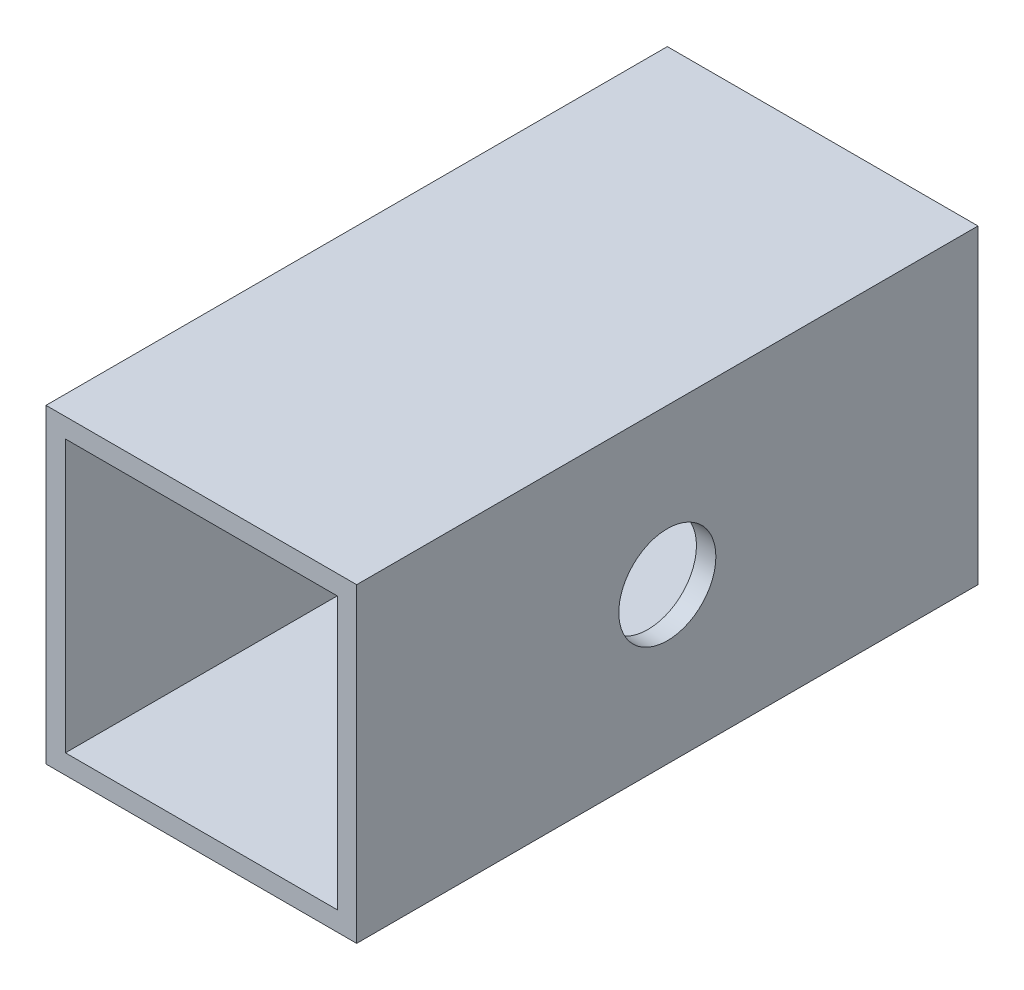
from build123d import *

# Parameters (mm, degrees)
SKETCH1_W           = 25.4
SKETCH1_H           = 25.4
SKETCH1_W_2         = 22.225
SKETCH1_H_2         = 22.225
BOSS_EXTRUDE1_DEPTH = 50.8
SKETCH2_R           = 3.96875
CUT_EXTRUDE2_DEPTH  = 59.198711326


with BuildPart() as part:
    # Sketch1 → Boss-Extrude1 (new body)
    with BuildSketch(Plane.XY):
        Rectangle(SKETCH1_W, SKETCH1_H)
        Rectangle(SKETCH1_W_2, SKETCH1_H_2, mode=Mode.SUBTRACT)
    extrude(amount=BOSS_EXTRUDE1_DEPTH)

    # Sketch2 → Cut-Extrude2 (cut, through all)
    with BuildSketch(Plane(origin=(12.7, 0, 0), x_dir=(0, 0, -1), z_dir=(1, 0, 0))):
        with Locations((-25.4, 0)):
            Circle(SKETCH2_R)
    extrude(amount=-CUT_EXTRUDE2_DEPTH, mode=Mode.SUBTRACT)


solid = part.part
